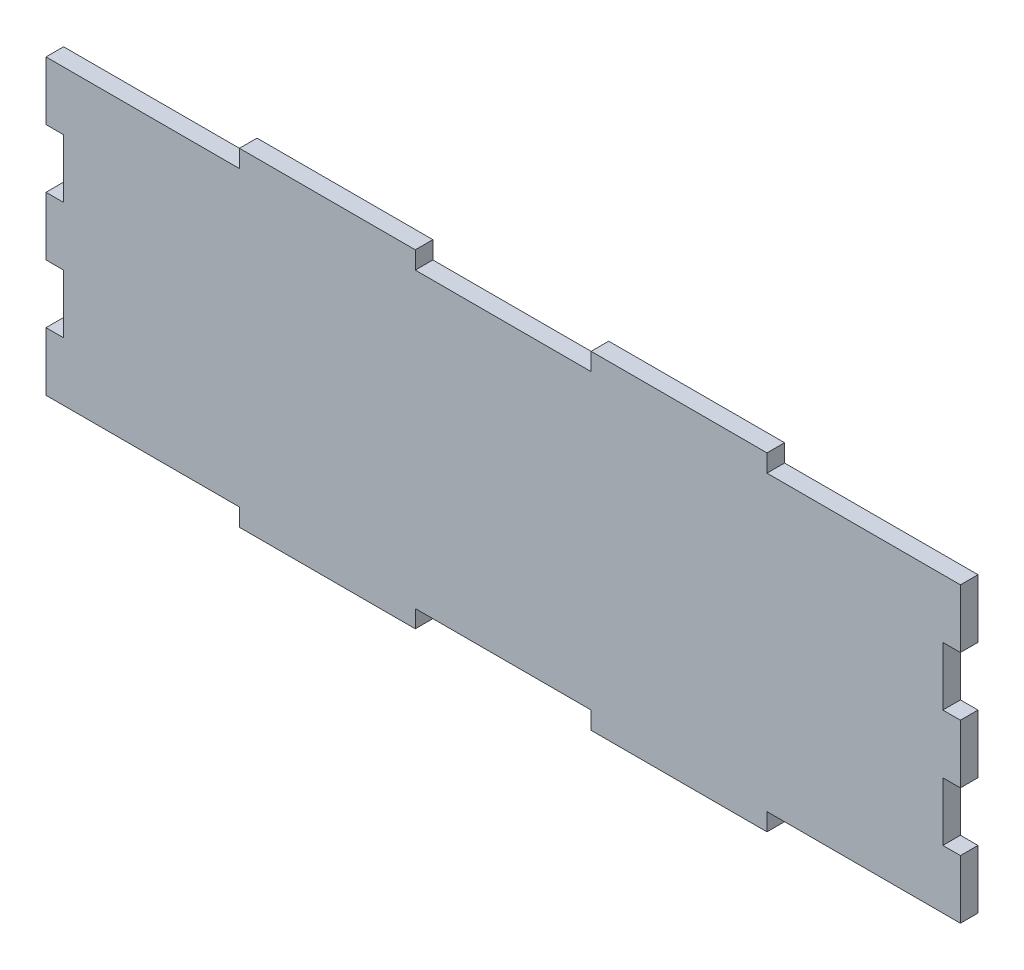
from build123d import *

# Parameters (mm, degrees)
RESSALTO_EXTRUS_O1_DEPTH = 3


with BuildPart() as part:
    # Esboço1 → Ressalto-extrusão1 (new body)
    with BuildSketch(Plane.XY):
        Polygon((45, 25), (75, 25), (78, 25), (78, 15), (75, 15), (75, 5), (78, 5), (78, -5), (75, -5), (75, -15), (78, -15), (78, -25), (75, -25), (45, -25), (45, -28), (15, -28), (15, -25), (-15, -25), (-15, -28), (-45, -28), (-45, -25), (-75, -25), (-78, -25), (-78, -15), (-75, -15), (-75, -5), (-78, -5), (-78, 5), (-75, 5), (-75, 15), (-78, 15), (-78, 25), (-75, 25), (-45, 25), (-45, 28), (-15, 28), (-15, 25), (15, 25), (15, 28), (45, 28), align=None)
    extrude(amount=RESSALTO_EXTRUS_O1_DEPTH)


solid = part.part
